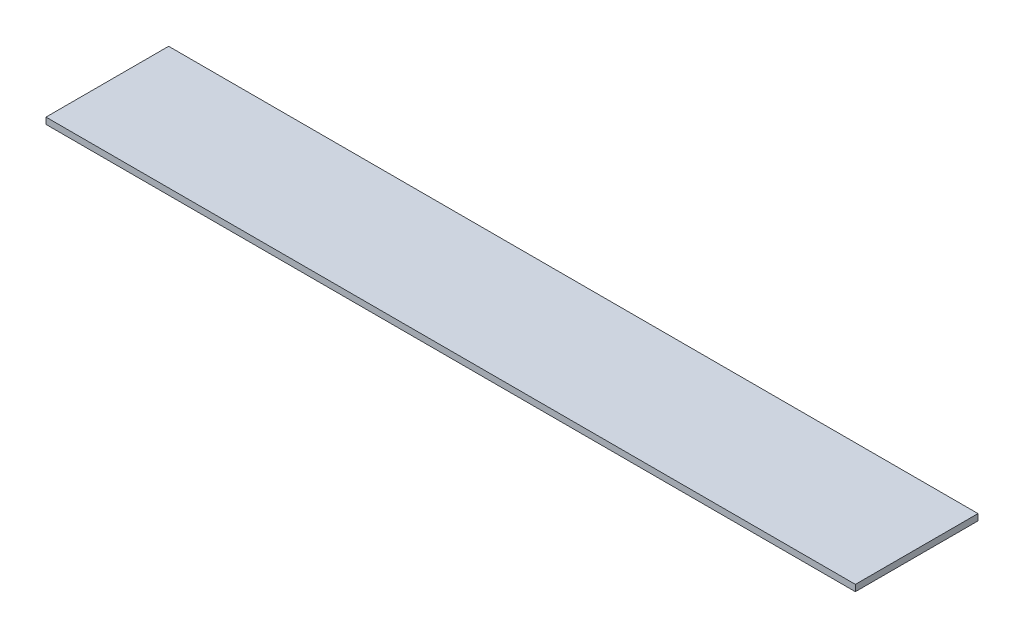
from build123d import *

# Parameters (mm, degrees)
SKETCH1_W           = 628.65
SKETCH1_H           = 95.25
BOSS_EXTRUDE1_DEPTH = 4.953


with BuildPart() as part:
    # Sketch1 → Boss-Extrude1 (new body)
    with BuildSketch(Plane(origin=(0, 0, 0), x_dir=(1, 0, 0), z_dir=(0, 1, 0))):
        Rectangle(SKETCH1_W, SKETCH1_H)
    extrude(amount=BOSS_EXTRUDE1_DEPTH)


solid = part.part
